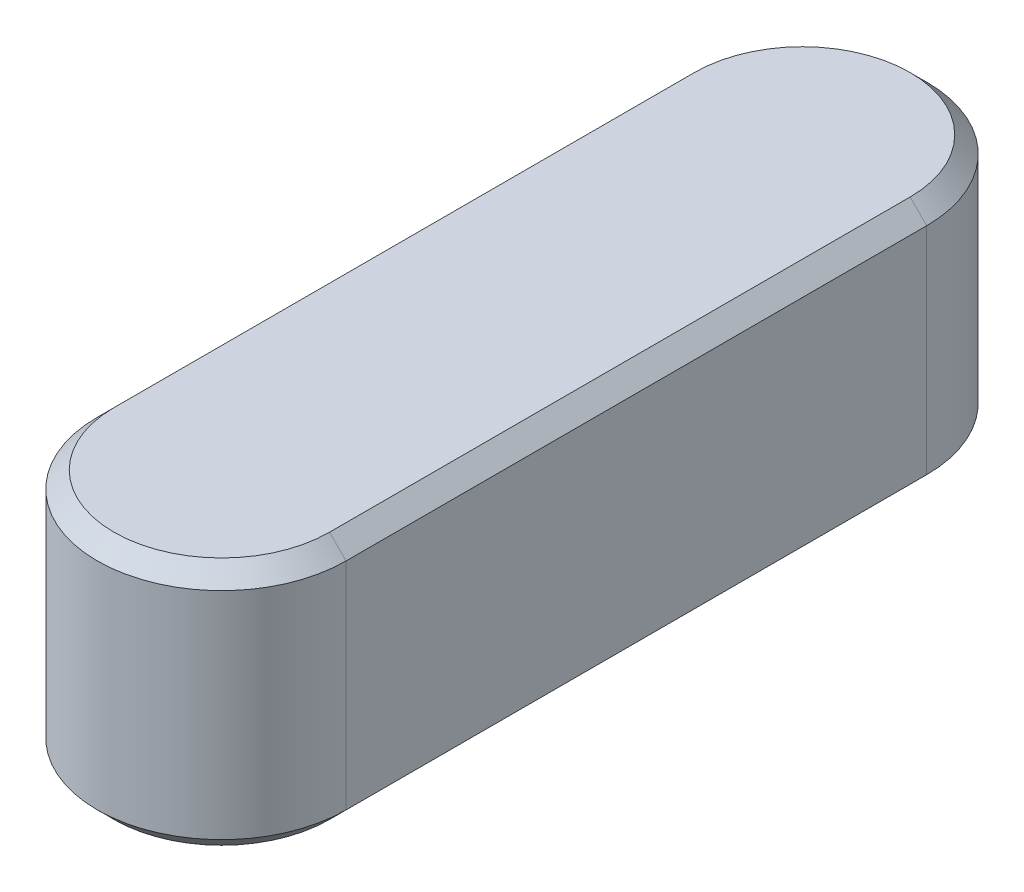
from build123d import *

# Parameters (mm, degrees)
EXTRUDE1_DEPTH = 3
CHAMFER1_SIZE  = 0.2


with BuildPart() as part:
    # Sketch1 → Extrude1 (new body)
    with BuildSketch(Plane(origin=(0, 0, 0), x_dir=(1, 0, 0), z_dir=(0, 1, 0))):
        with BuildLine():
            Line((-24.994827586, 23.283333333), (-24.994827586, 16.283333333))
            ThreePointArc((-24.994827586, 16.283333333), (-26.494827586, 14.783333333), (-27.994827586, 16.283333333))
            Line((-27.994827586, 16.283333333), (-27.994827586, 23.283333333))
            ThreePointArc((-27.994827586, 23.283333333), (-26.494827586, 24.783333333), (-24.994827586, 23.283333333))
        make_face()
    extrude(amount=EXTRUDE1_DEPTH)

    # Chamfer1
    chamfer1_edges = [part.edges().sort_by_distance(p)[0] for p in [
        (-26.494827586, 3, -14.783333333),
        (-24.994827586, 3, -19.783333333),
        (-26.494827586, 3, -24.783333333),
        (-24.994827586, 0, -19.783333333),
        (-26.494827586, 0, -14.783333333),
        (-27.994827586, 0, -19.783333333),
        (-26.494827586, 0, -24.783333333),
        (-27.994827586, 3, -19.783333333),
    ]]
    chamfer(chamfer1_edges, length=CHAMFER1_SIZE)


solid = part.part
